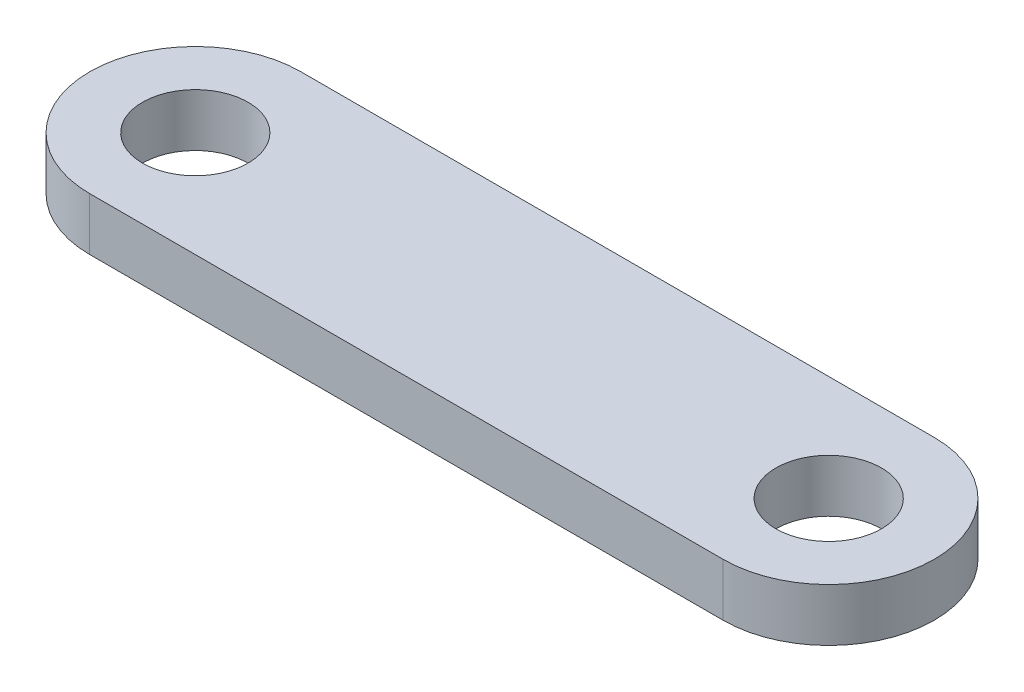
from build123d import *

# Parameters (mm, degrees)
SKETCH1_R           = 5
BOSS_EXTRUDE1_DEPTH = 5


with BuildPart() as part:
    # Sketch1 → Boss-Extrude1 (new body)
    with BuildSketch(Plane(origin=(0, 0, 0), x_dir=(1, 0, 0), z_dir=(0, 1, 0))):
        with BuildLine():
            Line((-51.223021583, 16.90647482), (8.776978417, 16.90647482))
            ThreePointArc((8.776978417, 16.90647482), (18.776978417, 6.90647482), (8.776978417, -3.09352518))
            Line((8.776978417, -3.09352518), (-51.223021583, -3.09352518))
            ThreePointArc((-51.223021583, -3.09352518), (-61.223021583, 6.90647482), (-51.223021583, 16.90647482))
        make_face()
        with Locations(Location((-51.223021583, 6.90647482, 0), (0, 0, 270))):
            Circle(SKETCH1_R, mode=Mode.SUBTRACT)
        with Locations(Location((8.776978417, 6.90647482, 0), (0, 0, 270))):
            Circle(SKETCH1_R, mode=Mode.SUBTRACT)
    extrude(amount=BOSS_EXTRUDE1_DEPTH)


solid = part.part
